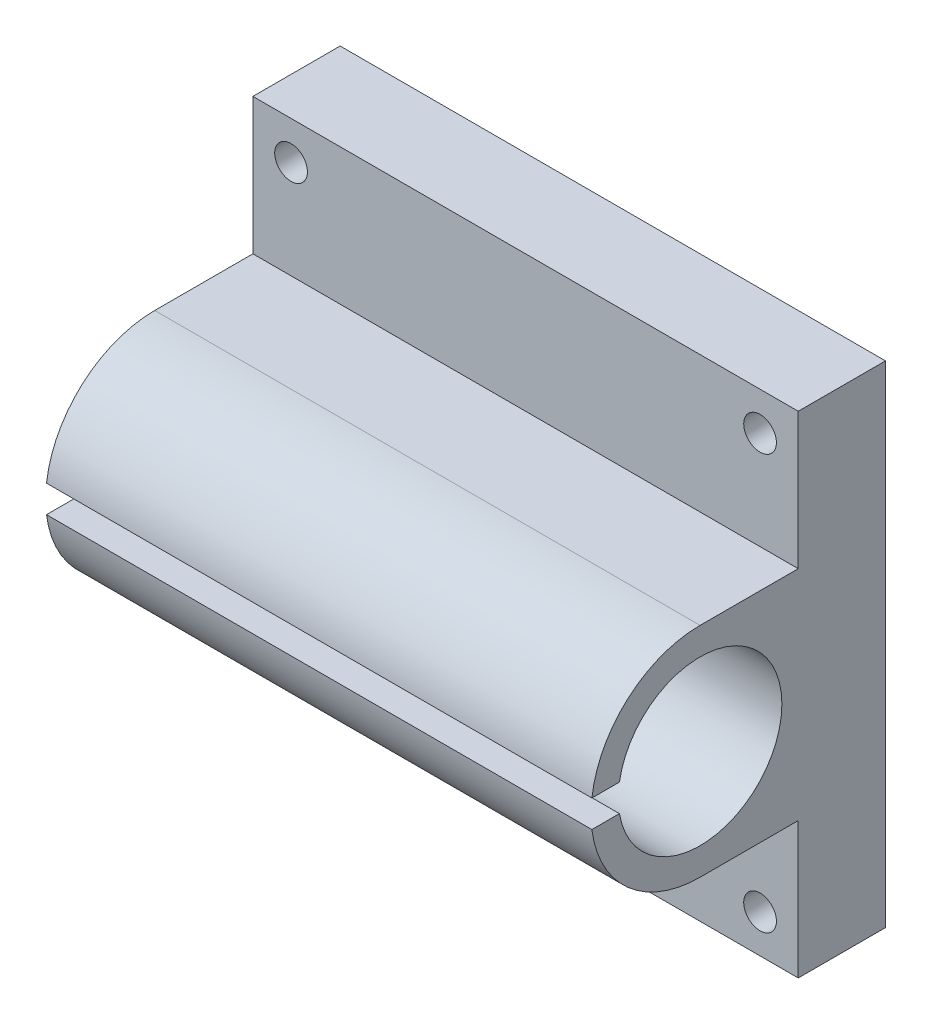
from build123d import *

# Parameters (mm, degrees)
SKETCH_1_W          = 50
SKETCH_1_H          = 45
EXTRUDE_1_DEPTH     = 8
SKETCH_2_R          = 7.5
EXTRUDE_2_DEPTH     = 50
SKETCH_3_W          = 6
SKETCH_3_H          = 2.5
CUT_EXTRUDE_1_DEPTH = 58
SKETCH_5_R          = 1.5
CUT_EXTRUDE_2_DEPTH = 10


with BuildPart() as part:
    # 草图1 → 凸台-拉伸1 (new body)
    with BuildSketch(Plane.XY):
        Rectangle(SKETCH_1_W, SKETCH_1_H)
    extrude(amount=EXTRUDE_1_DEPTH)

    # 草图2 → 凸台-拉伸2 (add)
    with BuildSketch(Plane(origin=(25, 0, 0), x_dir=(0, 0, -1), z_dir=(1, 0, 0))):
        with BuildLine():
            Line((-8, 10), (-17, 10))
            ThreePointArc((-17, 10), (-27, 0), (-17, -10))
            Line((-17, -10), (-8, -10))
            Line((-8, -10), (-8, 10))
        make_face()
        with Locations((-17, 0)):
            Circle(SKETCH_2_R, mode=Mode.SUBTRACT)
    extrude(amount=-EXTRUDE_2_DEPTH)

    # 草图3 → 切除-拉伸1 (cut)
    with BuildSketch(Plane(origin=(25, 0, 0), x_dir=(0, 0, -1), z_dir=(1, 0, 0))):
        with Locations((-24.5, 0)):
            Rectangle(SKETCH_3_W, SKETCH_3_H)
    extrude(amount=-CUT_EXTRUDE_1_DEPTH, mode=Mode.SUBTRACT)

    # 草图5 → 切除-拉伸2 (cut)
    with BuildSketch(Plane.XY.offset(8)):
        with Locations((-21.5, 19)):
            Circle(SKETCH_5_R)
        with Locations(Location((21.5, 19, 0), (0, 0, 180))):
            Circle(SKETCH_5_R)
        with Locations((21.5, -19)):
            Circle(SKETCH_5_R)
        with Locations(Location((-21.5, -19, 0), (0, 0, 180))):
            Circle(SKETCH_5_R)
    extrude(amount=-CUT_EXTRUDE_2_DEPTH, mode=Mode.SUBTRACT)


solid = part.part
